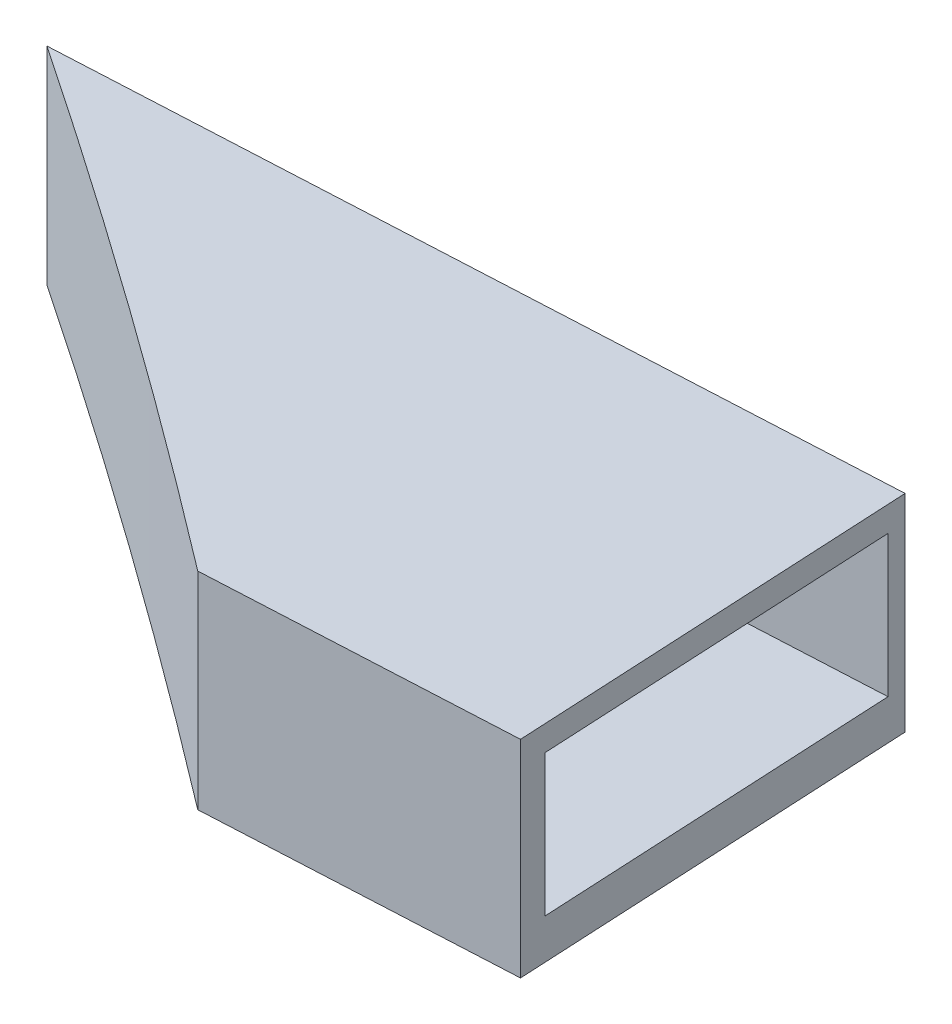
from build123d import *

# Parameters (mm, degrees)
BOSS_EXTRUDE2_DEPTH = 19
SKETCH3_W           = 33.25
SKETCH3_H           = 13
CUT_EXTRUDE2_DEPTH  = 19


with BuildPart() as part:
    # Sketch1 → Boss-Extrude2 (new body)
    with BuildSketch(Plane(origin=(0, 0, 0), x_dir=(1, 0, 0), z_dir=(0, 1, 0))):
        with BuildLine():
            Line((550.386370436, 820.819715378), (625.440328141, 824.647674335))
            Line((625.440328141, 824.647674335), (627.340180934, 787.397674335))
            Line((627.340180934, 787.397674335), (599.115957856, 785.958161072))
            ThreePointArc((599.115957856, 785.958161072), (575.015419514, 803.758315189), (550.386370436, 820.819715378))
        make_face()
    extrude(amount=BOSS_EXTRUDE2_DEPTH)

    # Sketch3 → Cut-Extrude2 (cut)
    with BuildSketch(Plane(origin=(665.767785772, 0, -33.955994289), x_dir=(-0.05093655241609126, 0, -0.9987018912708451), z_dir=(0.9987018912708452, 0, -0.05093655241609127))):
        with Locations((773.435764615, 10.189365534)):
            Rectangle(SKETCH3_W, SKETCH3_H)
    extrude(amount=-CUT_EXTRUDE2_DEPTH, mode=Mode.SUBTRACT)


solid = part.part
